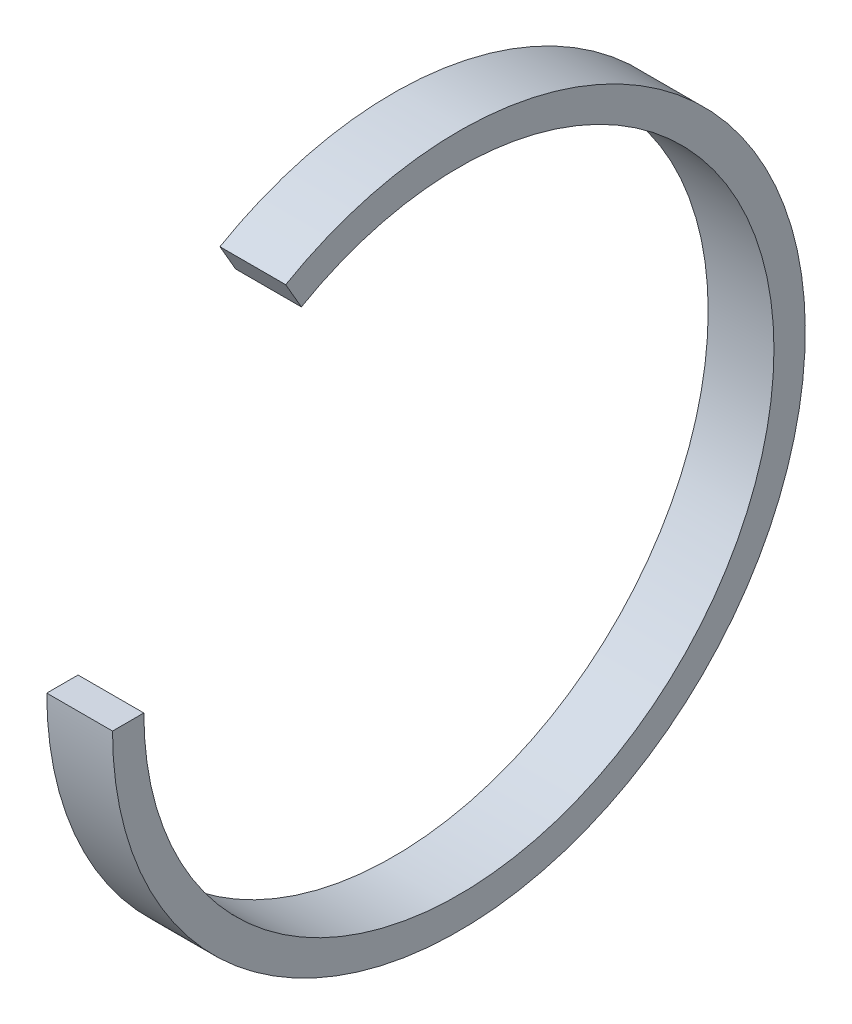
from build123d import *

# Parameters (mm, degrees)
BOSS_EXTRUDE1_DEPTH = 10.5


with BuildPart() as part:
    # Sketch1 → Boss-Extrude1 (new body)
    with BuildSketch(Plane(origin=(0, 0, 0), x_dir=(0, -1, 0), z_dir=(-1, 0, 0))):
        with BuildLine():
            Line((-43.561077523, 25.150000497), (-47.891204829, 27.65))
            ThreePointArc((-47.891204829, 27.65), (27.650005921, -47.891197746), (3.173e-06, 55.300005496))
            Line((3.173e-06, 55.300005496), (3.173e-06, 50.300005496))
            ThreePointArc((3.173e-06, 50.300005496), (25.150005673, -43.561070871), (-43.561077523, 25.150000497))
        make_face()
    extrude(amount=-BOSS_EXTRUDE1_DEPTH)


solid = part.part
